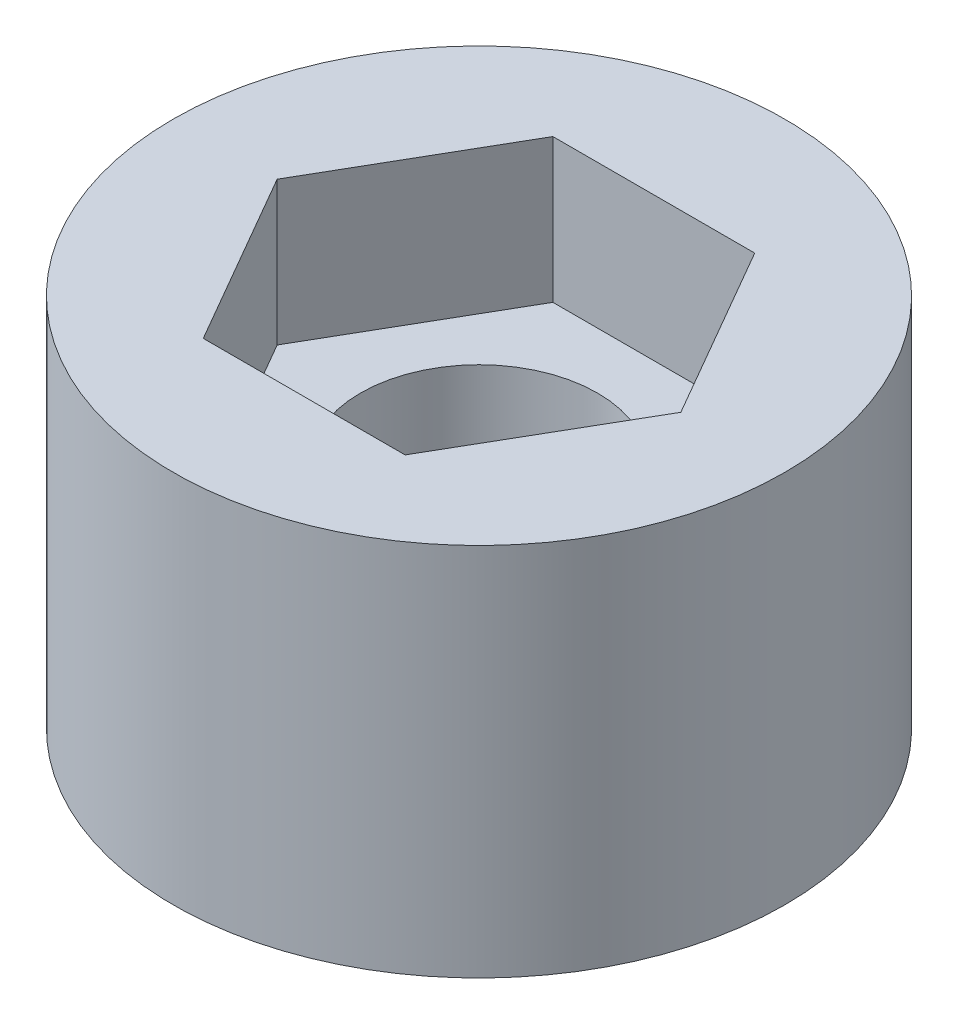
from build123d import *

# Parameters (mm, degrees)
SKETCH1_R           = 4.9
SKETCH1_R_2         = 1.9
EXTRUDE_THIN1_DEPTH = 6
CUT_EXTRUDE1_DEPTH  = 2.3


with BuildPart() as part:
    # Sketch1 → Extrude-Thin1 (new body)
    with BuildSketch(Plane(origin=(0, 0, 0), x_dir=(1, 0, 0), z_dir=(0, 1, 0))):
        Circle(SKETCH1_R)
        Circle(SKETCH1_R_2, mode=Mode.SUBTRACT)
    extrude(amount=EXTRUDE_THIN1_DEPTH)

    # Sketch2 → Cut-Extrude1 (cut)
    with BuildSketch(Plane(origin=(0, 6, 0), x_dir=(1, 0, 0), z_dir=(0, 1, 0))):
        Polygon((3.233161507, 0), (1.616580754, 2.8), (-1.616580754, 2.8), (-3.233161507, 0), (-1.616580754, -2.8), (1.616580754, -2.8), align=None)
    extrude(amount=-CUT_EXTRUDE1_DEPTH, mode=Mode.SUBTRACT)


solid = part.part
